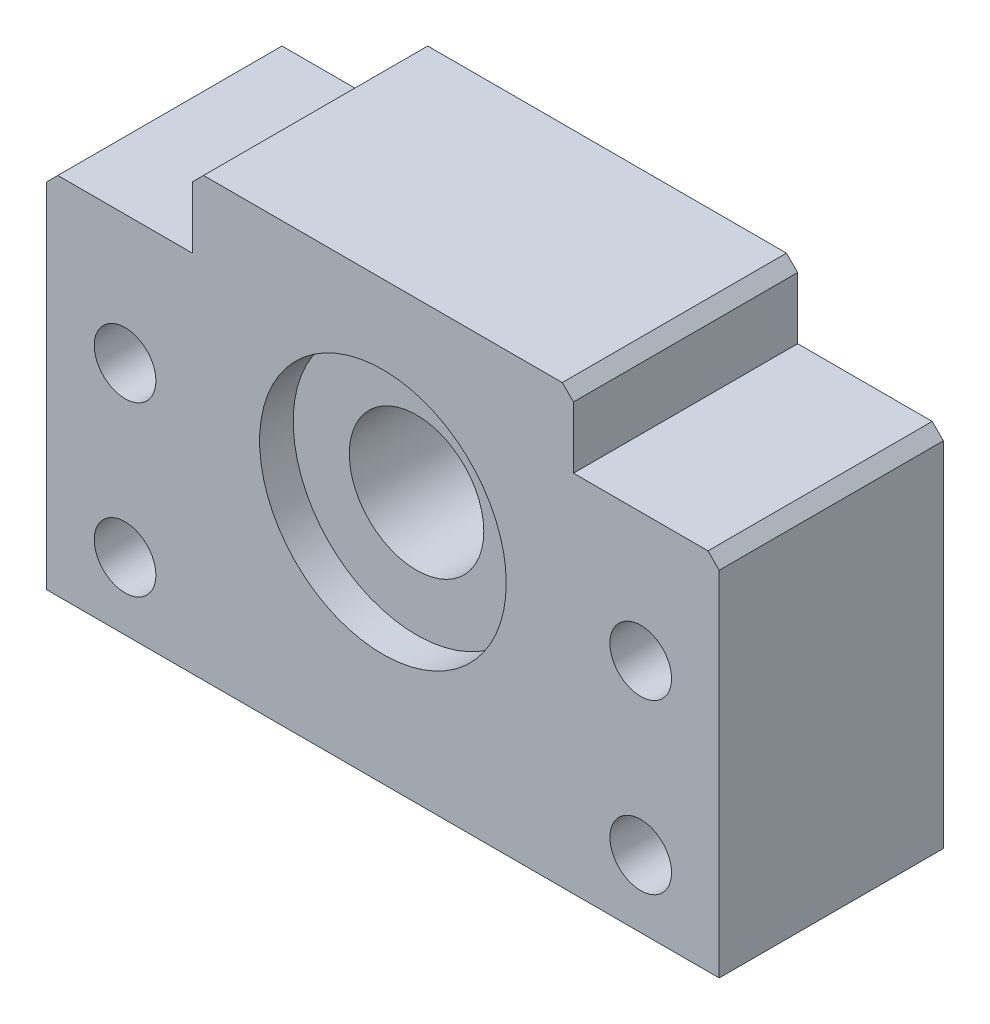
from build123d import *

# Parameters (mm, degrees)
EXTRUDE_1_DEPTH     = 20
CHAMFER_1_SIZE      = 1
CHAMFER_2_SIZE      = 1
SKETCH_2_R          = 2.75
CUT_EXTRUDE_1_DEPTH = 20
SKETCH_4_R          = 6
CUT_EXTRUDE_2_DEPTH = 20
SKETCH_5_R          = 11
CUT_EXTRUDE_3_DEPTH = 3


with BuildPart() as part:
    # 草图1 → 凸台-拉伸1 (new body)
    with BuildSketch(Plane.XY):
        Polygon((-30, 0), (30, 0), (30, 32.5), (17, 32.5), (17, 39), (-17, 39), (-17, 32.5), (-30, 32.5), align=None)
    extrude(amount=EXTRUDE_1_DEPTH)

    # 倒角1
    chamfer_1_edges = [part.edges().sort_by_distance(p)[0] for p in [
        (17, 39, 10),
    ]]
    chamfer(chamfer_1_edges, length=CHAMFER_1_SIZE)

    # 倒角2
    chamfer_2_edges = [part.edges().sort_by_distance(p)[0] for p in [
        (-30, 32.5, 10),
        (-17, 39, 10),
        (30, 32.5, 10),
    ]]
    chamfer(chamfer_2_edges, length=CHAMFER_2_SIZE)

    # 草图2 → 切除-拉伸1 (cut)
    with BuildSketch(Plane.XY.offset(20)):
        with Locations((-23, 21)):
            Circle(SKETCH_2_R)
        with Locations((-23, 6)):
            Circle(SKETCH_2_R)
    cut_extrude_1 = extrude(amount=-CUT_EXTRUDE_1_DEPTH, mode=Mode.SUBTRACT)

    # 镜向1: 切除-拉伸1 across plane
    add(cut_extrude_1.mirror(Plane(origin=(0, 0, 0), x_dir=(0, 0, 1), z_dir=(1, 0, 0))), mode=Mode.SUBTRACT)

    # 草图4 → 切除-拉伸2 (cut)
    with BuildSketch(Plane.XY.offset(20)):
        with Locations((0, 21)):
            Circle(SKETCH_4_R)
    extrude(amount=-CUT_EXTRUDE_2_DEPTH, mode=Mode.SUBTRACT)

    # 草图5 → 切除-拉伸3 (cut)
    with BuildSketch(Plane.XY.offset(20)):
        with Locations((0, 21)):
            Circle(SKETCH_5_R)
    cut_extrude_3 = extrude(amount=-CUT_EXTRUDE_3_DEPTH, mode=Mode.SUBTRACT)

    # 镜向2: 切除-拉伸3 across plane
    add(cut_extrude_3.mirror(Plane(origin=(0, 0, 10), x_dir=(1, 0, 0), z_dir=(0, 0, -1))), mode=Mode.SUBTRACT)


solid = part.part
